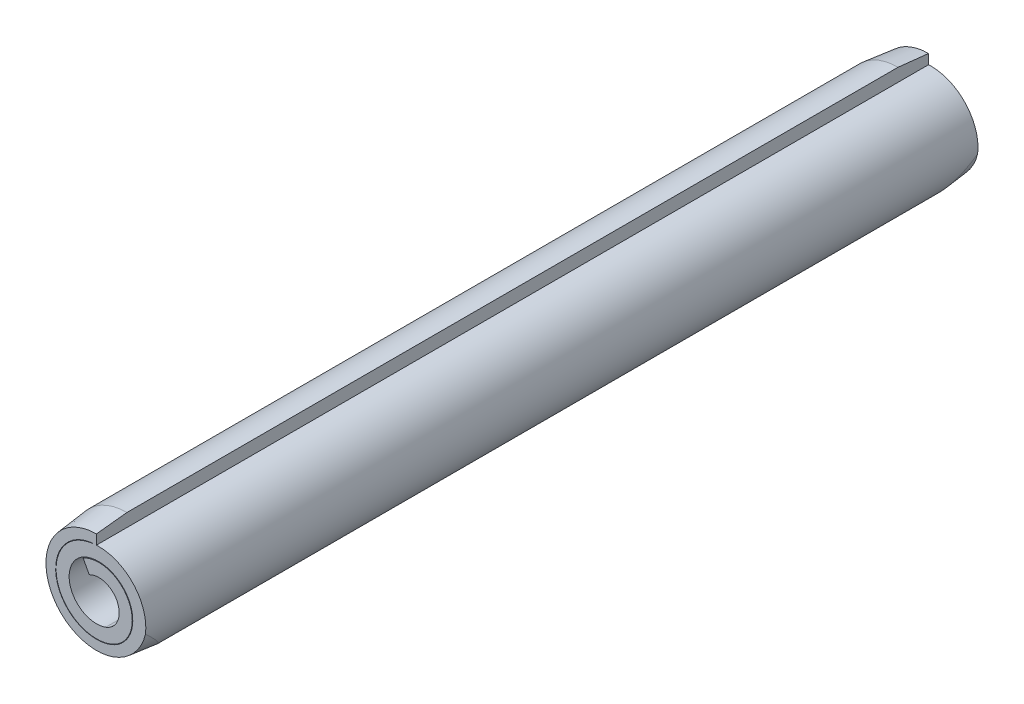
from build123d import *

# Parameters (mm, degrees)
EXTRUDE_THIN1_DEPTH = 19.05


with BuildPart() as part:
    # Sketch2 → Extrude-Thin1 (new, symmetric)
    with BuildSketch(Plane.XY):
        with BuildLine():
            ThreePointArc((0, 2.4638), (-2.426369342, -0.42783438), (0.842669229, -2.315214679))
            ThreePointArc((0.842669229, -2.315214679), (2.131146498, 0.447933741), (-0.632001922, 1.736411009))
            ThreePointArc((-0.632001922, 1.736411009), (-1.736411009, -0.632001922), (0.632001922, -1.736411009))
            ThreePointArc((0.632001922, -1.736411009), (1.507998215, 0.326065347), (-0.610244185, 1.056973933))
            Line((-0.610244185, 1.056973933), (-0.33020525, 0.529195203))
            ThreePointArc((-0.33020525, 0.529195203), (0.962075668, 0.083288153), (0.427654634, -1.17497145))
            ThreePointArc((0.427654634, -1.17497145), (-1.17497145, -0.427654634), (-0.427654634, 1.17497145))
            ThreePointArc((-0.427654634, 1.17497145), (1.569706938, 0.243586453), (0.638321941, -1.753775119))
            ThreePointArc((0.638321941, -1.753775119), (-1.837974776, -0.324084543), (0, 1.8663285))
            Line((0, 1.8663285), (0, 2.4638))
        make_face()
    extrude(amount=EXTRUDE_THIN1_DEPTH, both=True)

    # Sketch3 → Cut-Revolve1 (revolve, cut)
    with BuildSketch(Plane(origin=(0, 0, 0), x_dir=(0, 0, -1), z_dir=(1, 0, 0))):
        Polygon((-19.05, 2.4638), (-19.05, 2.3114), (-17.653, 2.4638), align=None)
        Polygon((17.653, 2.4638), (19.05, 2.4638), (19.05, 2.3114), align=None)
    revolve(axis=Axis((0, 0, 0), (0, 0, 1)), mode=Mode.SUBTRACT)


solid = part.part
